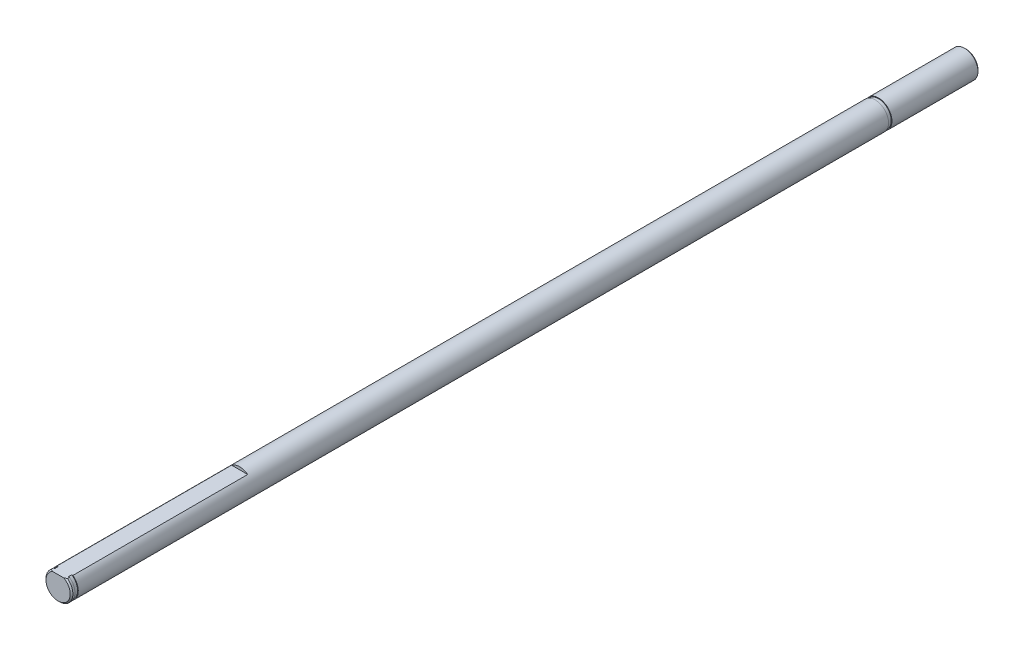
from build123d import *

# Parameters (mm, degrees)
SKIZZE1_R                       = 2
AUFSATZ_LINEAR_AUSTRAGEN1_DEPTH = 67.5
SKIZZE7_W                       = 0.5
SKIZZE7_H                       = 0.1
SCHNITT_LINEAR_AUSTRAGEN1_DEPTH = 27
FASE1_SIZE                      = 0.2


with BuildPart() as part:
    # Skizze1 → Aufsatz-Linear austragen1 (new, symmetric)
    with BuildSketch(Plane.XY):
        Circle(SKIZZE1_R)
    extrude(amount=AUFSATZ_LINEAR_AUSTRAGEN1_DEPTH, both=True)

    # Skizze7 → Schnitt-Rotation1 (revolve, cut)
    with BuildSketch(Plane(origin=(0, 0, 0), x_dir=(0, 0, -1), z_dir=(1, 0, 0))):
        with Locations((-66.75, 1.95)):
            Rectangle(SKIZZE7_W, SKIZZE7_H)
        with Locations((54.25, 1.95)):
            Rectangle(SKIZZE7_W, SKIZZE7_H)
    revolve(axis=Axis((0, 0, -67.5), (0, 0, 1)), mode=Mode.SUBTRACT)

    # Skizze8 → Schnitt-Linear austragen1 (cut)
    with BuildSketch(Plane.XY.offset(67.5)):
        with BuildLine():
            Line((1.2, 1.6), (-1.2, 1.6))
            ThreePointArc((-1.2, 1.6), (0, 2), (1.2, 1.6))
        make_face()
    extrude(amount=-SCHNITT_LINEAR_AUSTRAGEN1_DEPTH, mode=Mode.SUBTRACT)

    # Fase1
    fase1_edges = [part.edges().sort_by_distance(p)[0] for p in [
        (-2, 0, -67.5),
        (0, -2, 67.5),
    ]]
    chamfer(fase1_edges, length=FASE1_SIZE)


solid = part.part
